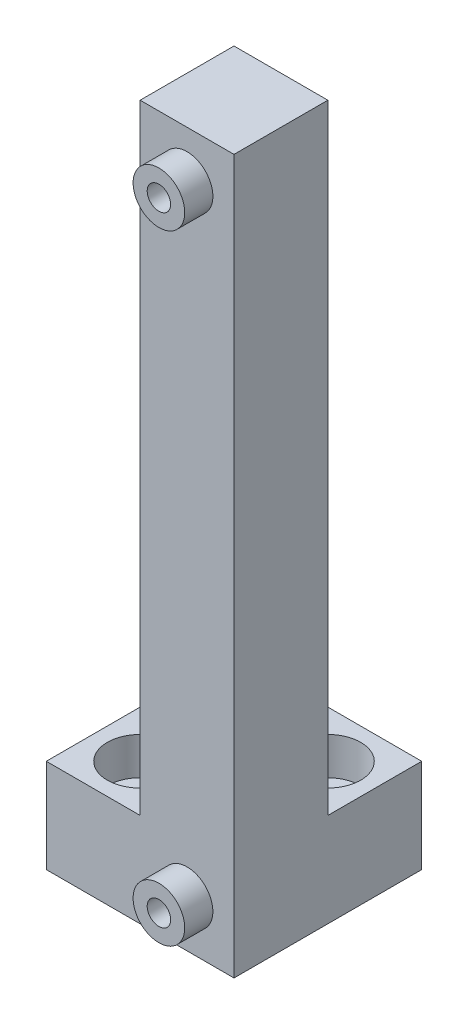
from build123d import *

# Parameters (mm, degrees)
BOSS_EXTRU_1_DEPTH      = 10
ESQUISSE2_R             = 2.75
BOSS_EXTRU_2_DEPTH      = 3
ESQUISSE3_R             = 1.25
ENL_V_MAT_EXTRU_1_DEPTH = 8
ESQUISSE4_W             = 10
ESQUISSE4_H             = 10
BOSS_EXTRU_3_DEPTH      = 10
ENL_V_MAT_EXTRU_2_REACH = 72.178
ESQUISSE5_R             = 1.75
ESQUISSE6_R             = 3.5
ENL_V_MAT_EXTRU_3_DEPTH = 4


with BuildPart() as part:
    # Esquisse1 → Boss.-Extru.1 (new body)
    with BuildSketch(Plane.XY):
        Polygon((-10, 76), (0, 76), (0, 0), (-20, 0), (-20, 10), (-10, 10), align=None)
    extrude(amount=BOSS_EXTRU_1_DEPTH)

    # Esquisse2 → Boss.-Extru.2 (add)
    with BuildSketch(Plane.XY.offset(10)):
        with Locations(Location((-5, 71, 0), (0, 0, 180))):
            Circle(ESQUISSE2_R)
        with Locations(Location((-5, 5, 0), (0, 0, 180))):
            Circle(ESQUISSE2_R)
    extrude(amount=BOSS_EXTRU_2_DEPTH)

    # Esquisse3 → Enlèv. mat.-Extru.1 (cut)
    with BuildSketch(Plane.XY.offset(13)):
        with Locations((-5, 71)):
            Circle(ESQUISSE3_R)
        with Locations((-5, 5)):
            Circle(ESQUISSE3_R)
    extrude(amount=-ENL_V_MAT_EXTRU_1_DEPTH, mode=Mode.SUBTRACT)

    # Esquisse4 → Boss.-Extru.3 (add)
    with BuildSketch(Plane(origin=(0, 0, 0), x_dir=(-1, 0, 0), z_dir=(0, 0, -1))):
        with Locations((5, 5)):
            Rectangle(ESQUISSE4_W, ESQUISSE4_H)
    extrude(amount=BOSS_EXTRU_3_DEPTH)

    # Esquisse5 → Enlèv. mat.-Extru.2 (cut, up to next)
    with BuildSketch(Plane(origin=(0, 10, 0), x_dir=(1, 0, 0), z_dir=(0, 1, 0)), mode=Mode.PRIVATE) as enl_v_mat_extru_2_sk1:
        with Locations(Location((-15, -5, 0), (0, 0, 180))):
            Circle(ESQUISSE5_R)
    enl_v_mat_extru_2_tool1 = extrude(enl_v_mat_extru_2_sk1.sketch, amount=-ENL_V_MAT_EXTRU_2_REACH, mode=Mode.PRIVATE) & part.part
    # Esquisse5 → Enlèv. mat.-Extru.2 (cut, up to next)
    with BuildSketch(Plane(origin=(0, 10, 0), x_dir=(1, 0, 0), z_dir=(0, 1, 0)), mode=Mode.PRIVATE) as enl_v_mat_extru_2_sk2:
        with Locations(Location((-5, 5, 0), (0, 0, 180))):
            Circle(ESQUISSE5_R)
    enl_v_mat_extru_2_tool2 = extrude(enl_v_mat_extru_2_sk2.sketch, amount=-ENL_V_MAT_EXTRU_2_REACH, mode=Mode.PRIVATE) & part.part
    add(enl_v_mat_extru_2_tool1.solids().sort_by_distance((-15, 10, 5))[0], mode=Mode.SUBTRACT)
    add(enl_v_mat_extru_2_tool2.solids().sort_by_distance((-5, 10, -5))[0], mode=Mode.SUBTRACT)

    # Esquisse6 → Enlèv. mat.-Extru.3 (cut)
    with BuildSketch(Plane(origin=(0, 10, 0), x_dir=(1, 0, 0), z_dir=(0, 1, 0))):
        with Locations(Location((-15, -5, 0), (0, 0, 180))):
            Circle(ESQUISSE6_R)
        with Locations(Location((-5, 5, 0), (0, 0, 180))):
            Circle(ESQUISSE6_R)
    extrude(amount=-ENL_V_MAT_EXTRU_3_DEPTH, mode=Mode.SUBTRACT)


solid = part.part
